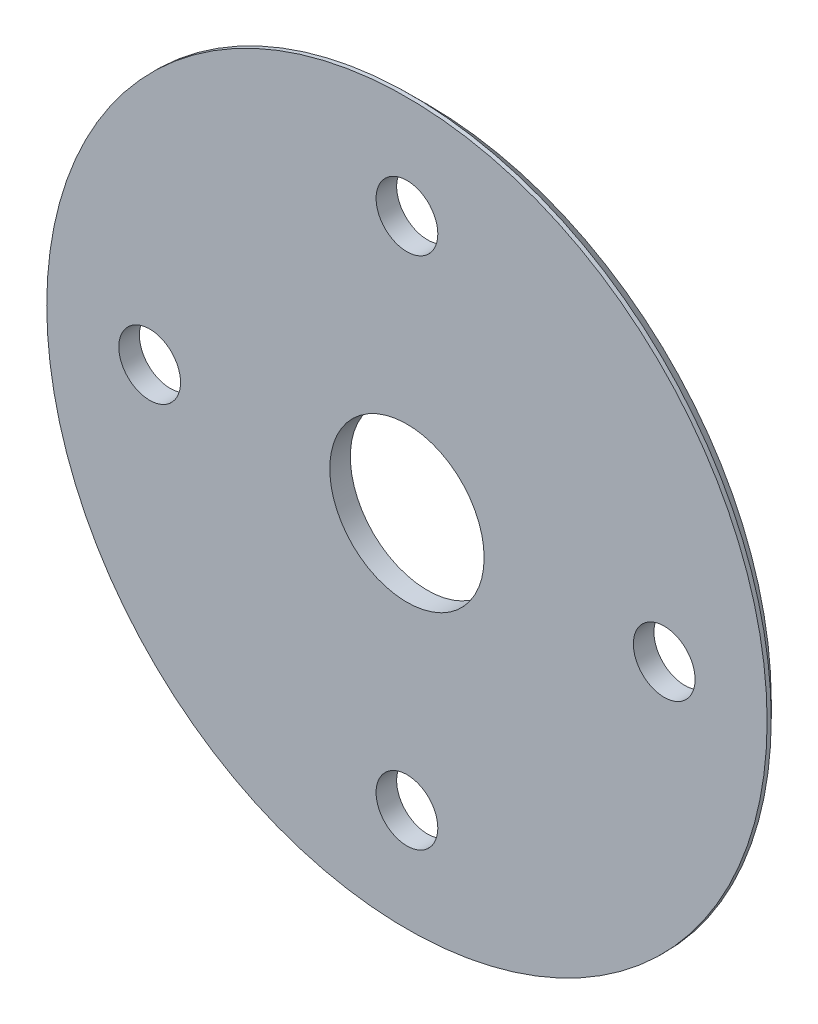
from build123d import *

# Parameters (mm, degrees)
SKETCH1_R           = 35
SKETCH1_R_2         = 7.5
SKETCH1_R_3         = 3
BOSS_EXTRUDE1_DEPTH = 2
CHAMFER1_SIZE       = 1.6


with BuildPart() as part:
    # Sketch1 → Boss-Extrude1 (new body)
    with BuildSketch(Plane.XY):
        Circle(SKETCH1_R)
        Circle(SKETCH1_R_2, mode=Mode.SUBTRACT)
        with Locations((25, 0)):
            Circle(SKETCH1_R_3, mode=Mode.SUBTRACT)
        with Locations((0, -25)):
            Circle(SKETCH1_R_3, mode=Mode.SUBTRACT)
        with Locations((-25, 0)):
            Circle(SKETCH1_R_3, mode=Mode.SUBTRACT)
        with Locations((0, 25)):
            Circle(SKETCH1_R_3, mode=Mode.SUBTRACT)
    extrude(amount=BOSS_EXTRUDE1_DEPTH)

    # Chamfer1
    chamfer1_edges = [part.edges().sort_by_distance(p)[0] for p in [
        (-35, 0, 0),
    ]]
    chamfer(chamfer1_edges, length=CHAMFER1_SIZE)


solid = part.part
